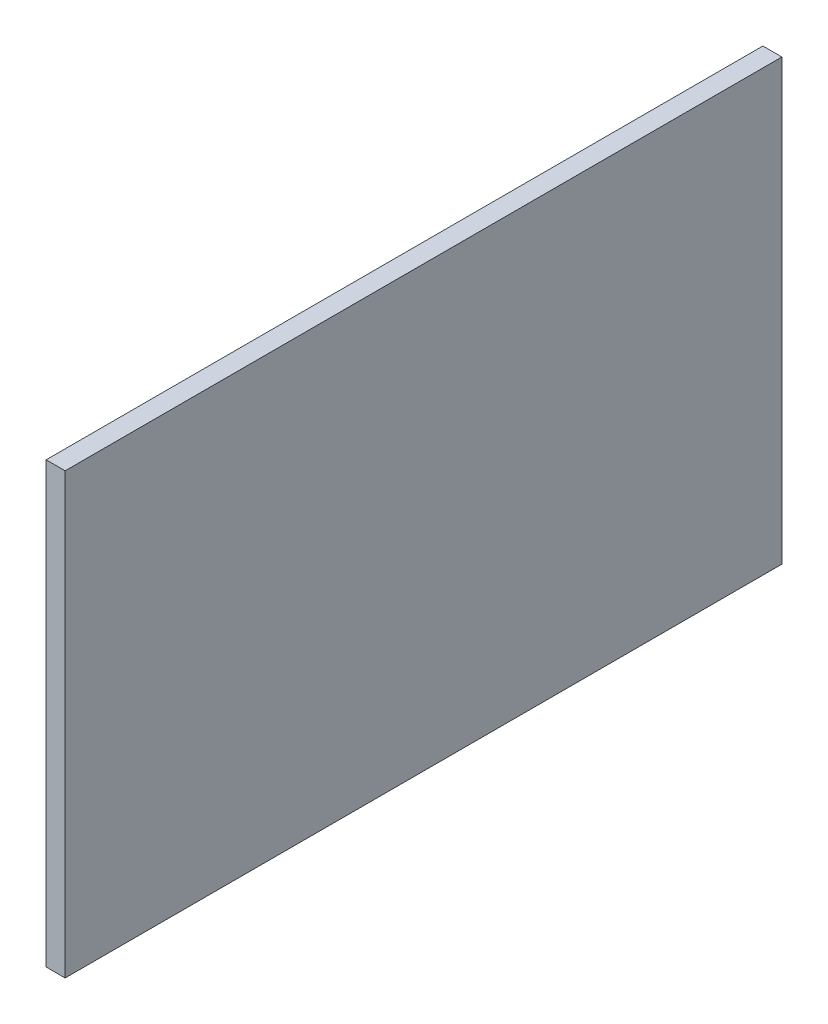
from build123d import *

# Parameters (mm, degrees)
SKETCH1_W           = 452
SKETCH1_H           = 277
BOSS_EXTRUDE1_DEPTH = 12


with BuildPart() as part:
    # Sketch1 → Boss-Extrude1 (new body)
    with BuildSketch(Plane(origin=(0, 0, 0), x_dir=(0, 0, -1), z_dir=(1, 0, 0))):
        with Locations((226, 138.5)):
            Rectangle(SKETCH1_W, SKETCH1_H)
    extrude(amount=BOSS_EXTRUDE1_DEPTH)


solid = part.part
